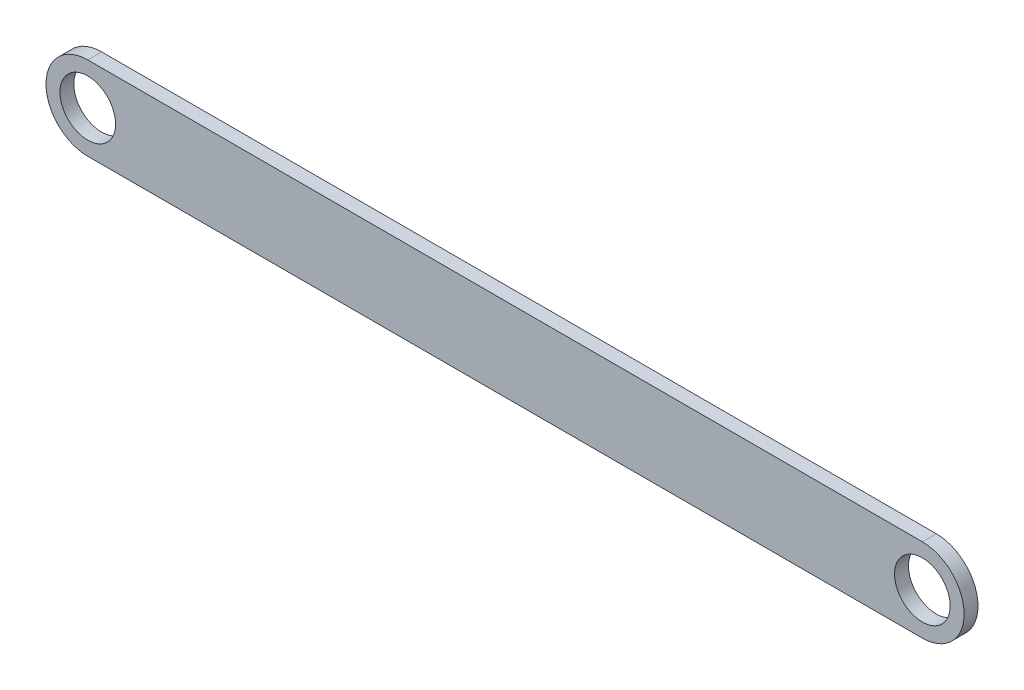
from build123d import *

# Parameters (mm, degrees)
SKETCH1_R           = 100
BOSS_EXTRUDE1_DEPTH = 50


with BuildPart() as part:
    # Sketch1 → Boss-Extrude1 (new body)
    with BuildSketch(Plane.XY):
        with BuildLine():
            Line((0, 150), (3000, 150))
            ThreePointArc((3000, 150), (3150, 0), (3000, -150))
            Line((3000, -150), (0, -150))
            ThreePointArc((0, -150), (-150, 0), (0, 150))
        make_face()
        Circle(SKETCH1_R, mode=Mode.SUBTRACT)
        with Locations((3000, 0)):
            Circle(SKETCH1_R, mode=Mode.SUBTRACT)
    extrude(amount=BOSS_EXTRUDE1_DEPTH)


solid = part.part
